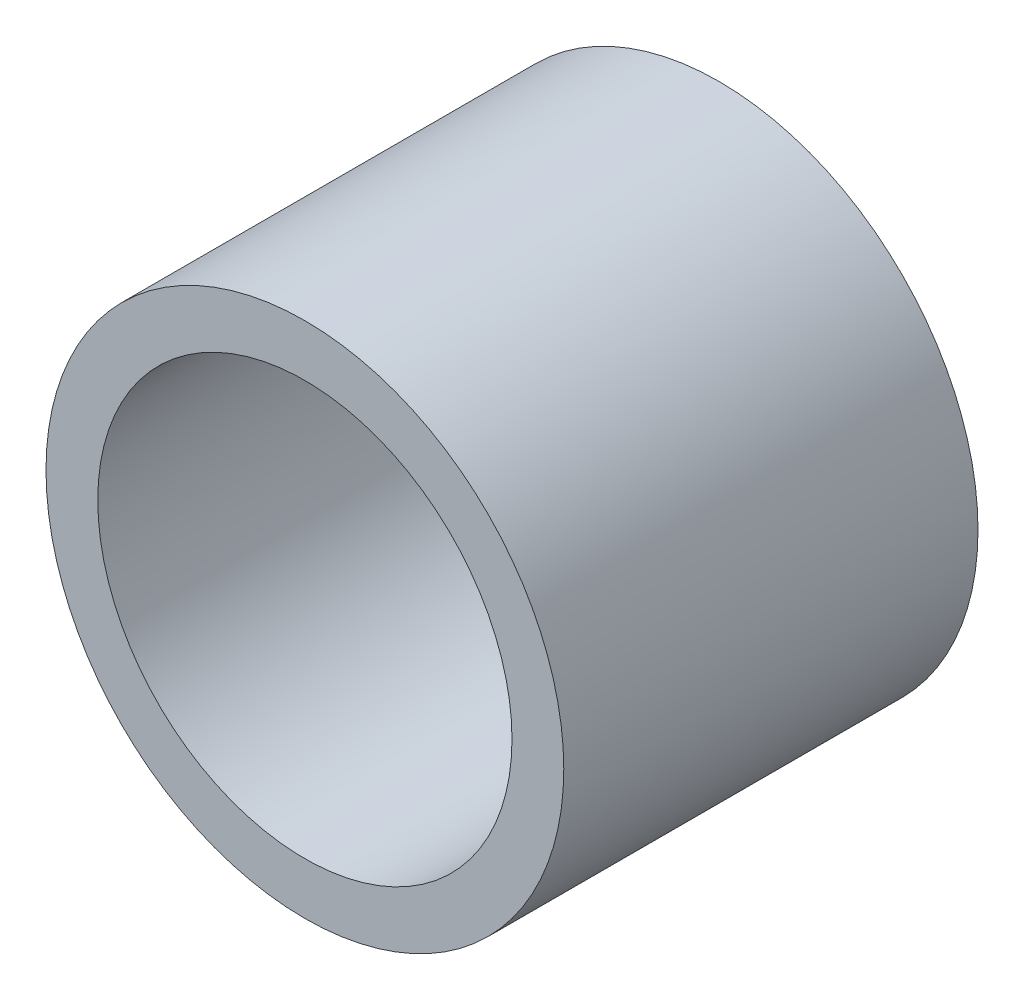
from build123d import *

# Parameters (mm, degrees)
ESQUISSE1_R             = 31.75
BOSS_EXTRU_1_DEPTH      = 50.8
ESQUISSE4_R             = 25.4
ENL_V_MAT_EXTRU_1_DEPTH = 43.45
ESQUISSE5_R             = 6.35
ENL_V_MAT_EXTRU_3_DEPTH = 7.35


with BuildPart() as part:
    # Esquisse1 → Boss.-Extru.1 (new body)
    with BuildSketch(Plane.XY):
        Circle(ESQUISSE1_R)
    extrude(amount=BOSS_EXTRU_1_DEPTH)

    # Esquisse4 → Enlèv. mat.-Extru.1 (cut)
    with BuildSketch(Plane.XY.offset(50.8)):
        Circle(ESQUISSE4_R)
    extrude(amount=-ENL_V_MAT_EXTRU_1_DEPTH, mode=Mode.SUBTRACT)

    # Esquisse5 → Enlèv. mat.-Extru.3 (cut)
    with BuildSketch(Plane(origin=(0, 0, 0), x_dir=(-1, 0, 0), z_dir=(0, 0, -1))):
        Circle(ESQUISSE5_R)
    extrude(amount=-ENL_V_MAT_EXTRU_3_DEPTH, mode=Mode.SUBTRACT)


solid = part.part
